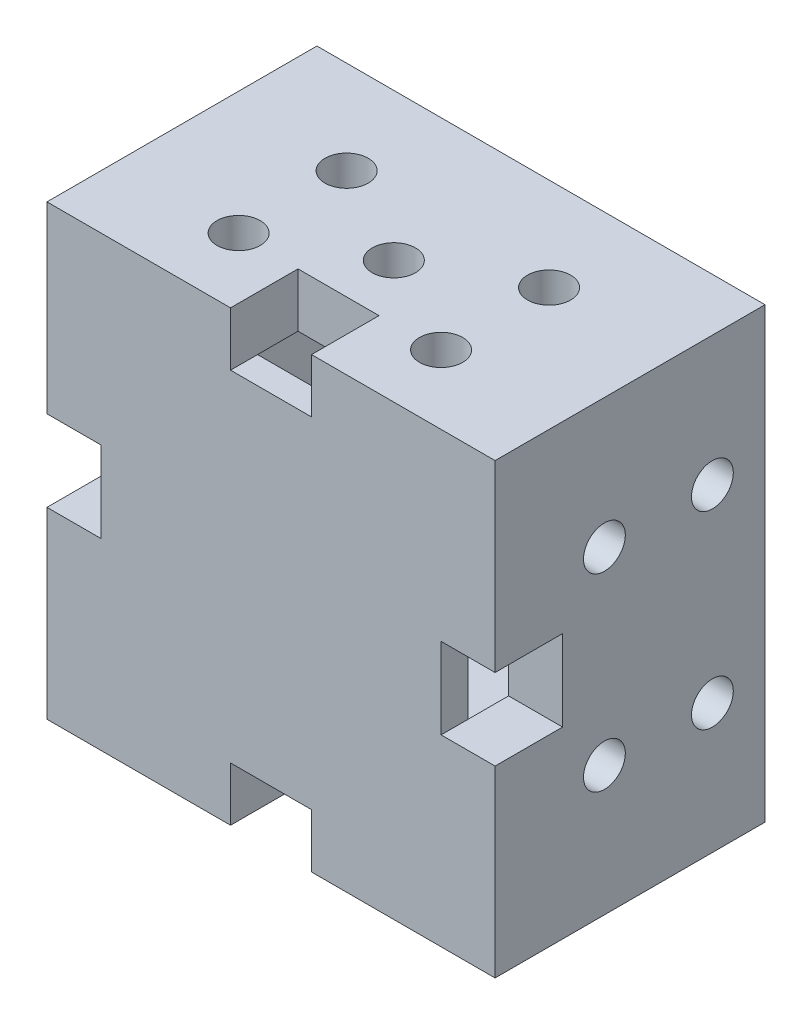
from build123d import *

# Parameters (mm, degrees)
SKETCH_1_W               = 33.2
SKETCH_1_H               = 33.2
EXTRUDE_1_DEPTH          = 18
SKETCH_2_W               = 33.2
SKETCH_2_H               = 33.2
EXTRUDE_2_DEPTH          = 2
CUT_EXTRUDE_1_DEPTH      = 40.09219871
CUT_EXTRUDE_1_DEPTH_BACK = 40.09219871
SKETCH_3_W               = 3
SKETCH_3_H               = 6
SKETCH_4_W               = 6
SKETCH_4_H               = 3
CUT_EXTRUDE_2_DEPTH      = 43.163965658
SKETCH_5_W               = 4
SKETCH_5_H               = 6
SKETCH_5_W_2             = 6
SKETCH_5_H_2             = 4
CUT_EXTRUDE_3_DEPTH      = 30.582427216
SKETCH_6_R               = 1.6
CUT_EXTRUDE_4_DEPTH      = 43.163965658
SKETCH_7_R               = 1.55
CUT_EXTRUDE_5_DEPTH      = 43.163965658


with BuildPart() as part:
    # 草图1 → 凸台-拉伸1 (new body)
    with BuildSketch(Plane.XY):
        Rectangle(SKETCH_1_W, SKETCH_1_H)
        with BuildLine():
            Line((11.6, -12.6), (-11.6, -12.6))
            ThreePointArc((-11.6, -12.6), (-12.1, -13.1), (-12.6, -12.6))
            Line((-12.6, -12.6), (-12.6, 12.6))
            ThreePointArc((-12.6, 12.6), (-12.1, 13.1), (-11.6, 12.6))
            Line((-11.6, 12.6), (11.6, 12.6))
            ThreePointArc((11.6, 12.6), (12.1, 13.1), (12.6, 12.6))
            Line((12.6, 12.6), (12.6, -12.6))
            ThreePointArc((12.6, -12.6), (12.1, -13.1), (11.6, -12.6))
        make_face(mode=Mode.SUBTRACT)
    extrude(amount=EXTRUDE_1_DEPTH)

    # 草图2 → 凸台-拉伸2 (add)
    with BuildSketch(Plane.XY.offset(18)):
        Rectangle(SKETCH_2_W, SKETCH_2_H)
    extrude(amount=EXTRUDE_2_DEPTH)

    # 草图3 → 切除-拉伸1 (cut, two sides: drawn at the far end of the back side and taken through both)
    with BuildSketch(Plane(origin=(-12.6, 0, 0), x_dir=(0, 0, -1), z_dir=(1, 0, 0)).offset(-CUT_EXTRUDE_1_DEPTH_BACK)):
        with Locations((-16.5, 0)):
            Rectangle(SKETCH_3_W, SKETCH_3_H)
    extrude(amount=CUT_EXTRUDE_1_DEPTH + CUT_EXTRUDE_1_DEPTH_BACK, mode=Mode.SUBTRACT)

    # 草图4 → 切除-拉伸2 (cut, through all)
    with BuildSketch(Plane(origin=(0, 16.6, 0), x_dir=(1, 0, 0), z_dir=(0, 1, 0))):
        with Locations((0, -16.5)):
            Rectangle(SKETCH_4_W, SKETCH_4_H)
    extrude(amount=-CUT_EXTRUDE_2_DEPTH, mode=Mode.SUBTRACT)

    # 草图5 → 切除-拉伸3 (cut, through all)
    with BuildSketch(Plane(origin=(0, 0, 18), x_dir=(-1, 0, 0), z_dir=(0, 0, -1))):
        with Locations((-14.6, 0)):
            Rectangle(SKETCH_5_W, SKETCH_5_H)
        with Locations((0, -14.6)):
            Rectangle(SKETCH_5_W_2, SKETCH_5_H_2)
        with Locations((14.6, 0)):
            Rectangle(SKETCH_5_W, SKETCH_5_H)
        with Locations((0, 14.6)):
            Rectangle(SKETCH_5_W_2, SKETCH_5_H_2)
    extrude(amount=-CUT_EXTRUDE_3_DEPTH, mode=Mode.SUBTRACT)

    # 草图6 → 切除-拉伸4 (cut, through all)
    with BuildSketch(Plane(origin=(0, 16.6, 0), x_dir=(1, 0, 0), z_dir=(0, 1, 0))):
        with Locations(Location((7.5, -6.9, 0), (0, 0, 270))):
            Circle(SKETCH_6_R)
        with Locations(Location((7.5, -14.9, 0), (0, 0, 270))):
            Circle(SKETCH_6_R)
        with Locations(Location((-7.5, -14.9, 0), (0, 0, 270))):
            Circle(SKETCH_6_R)
        with Locations(Location((-7.5, -6.9, 0), (0, 0, 270))):
            Circle(SKETCH_6_R)
        with Locations(Location((0, -10.9, 0), (0, 0, 270))):
            Circle(SKETCH_6_R)
    extrude(amount=-CUT_EXTRUDE_4_DEPTH, mode=Mode.SUBTRACT)

    # 草图7 → 切除-拉伸5 (cut, through all)
    with BuildSketch(Plane(origin=(16.6, 0, 0), x_dir=(0, 0, -1), z_dir=(1, 0, 0))):
        with Locations((-3.9, -7)):
            Circle(SKETCH_7_R)
        with Locations((-11.9, -7)):
            Circle(SKETCH_7_R)
        with Locations((-11.9, 7)):
            Circle(SKETCH_7_R)
        with Locations((-3.9, 7)):
            Circle(SKETCH_7_R)
    extrude(amount=-CUT_EXTRUDE_5_DEPTH, mode=Mode.SUBTRACT)


solid = part.part
